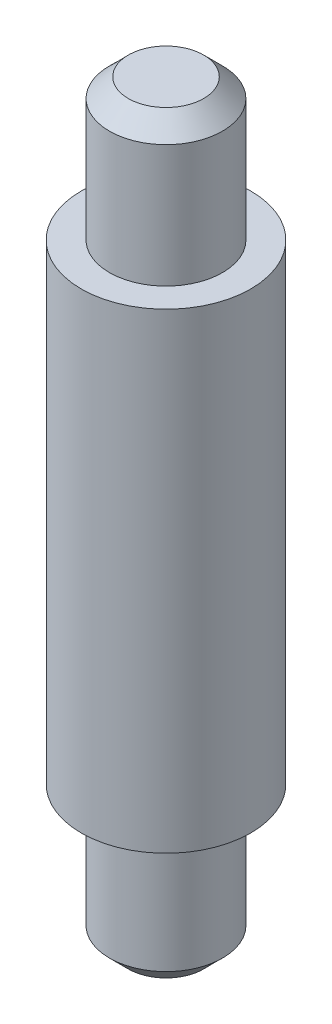
from build123d import *

# Parameters (mm, degrees)
SKETCH1_R           = 9
BOSS_EXTRUDE1_DEPTH = 25
SKETCH2_R           = 6
BOSS_EXTRUDE2_DEPTH = 40
CHAMFER1_SIZE       = 2


with BuildPart() as part:
    # Sketch1 → Boss-Extrude1 (new, symmetric)
    with BuildSketch(Plane(origin=(0, 0, 0), x_dir=(1, 0, 0), z_dir=(0, 1, 0))):
        with Locations(Location((0, 0, 0), (0, 0, 270))):
            Circle(SKETCH1_R)
    extrude(amount=BOSS_EXTRUDE1_DEPTH, both=True)

    # Sketch2 → Boss-Extrude2 (add, symmetric)
    with BuildSketch(Plane(origin=(0, 0, 0), x_dir=(1, 0, 0), z_dir=(0, 1, 0))):
        with Locations(Location((0, 0, 0), (0, 0, 270))):
            Circle(SKETCH2_R)
    extrude(amount=BOSS_EXTRUDE2_DEPTH, both=True)

    # Chamfer1
    chamfer1_edges = [part.edges().sort_by_distance(p)[0] for p in [
        (0, -40, -6),
        (0, 40, -6),
    ]]
    chamfer(chamfer1_edges, length=CHAMFER1_SIZE)


solid = part.part
